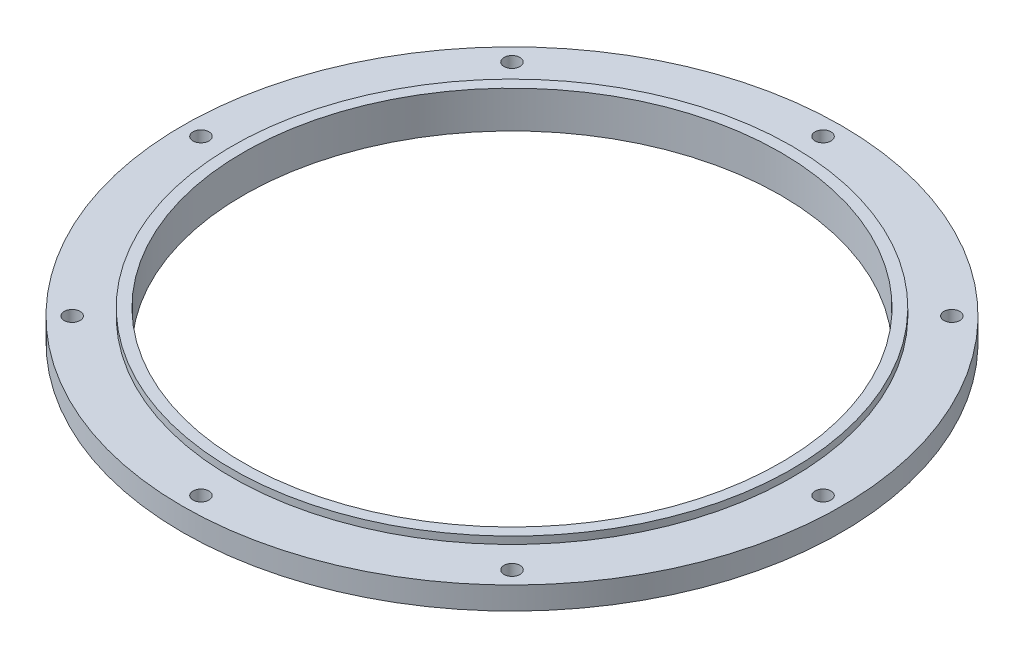
from build123d import *

# Parameters (mm, degrees)
SKETCH_2_R          = 2.15
CUT_EXTRUDE_1_DEPTH = 10


with BuildPart() as part:
    # 草图1 → 旋转1 (revolve)
    with BuildSketch(Plane.XY, mode=Mode.PRIVATE) as revolve_1_sk:
        Polygon((75.5, 0), (88.9, 0), (88.9, 6.1), (75.5, 6.1), (75.5, 8.05), (72.5, 8.05), (72.5, -1.95), (75.5, -1.95), align=None)
    revolve(revolve_1_sk.sketch.rotate(Axis((0, 0, 0), (0, 1, 0)), 90), axis=Axis((0, 0, 0), (0, 1, 0)))

    # 草图2 → 切除-拉伸1 (cut)
    with BuildSketch(Plane(origin=(0, 6.1, 0), x_dir=(1, 0, 0), z_dir=(0, 1, 0))):
        with Locations(Location((-83.9, 0, 0), (0, 0, 270))):
            Circle(SKETCH_2_R)
        with Locations(Location((-59.326258942, 59.326258942, 0), (0, 0, 270))):
            Circle(SKETCH_2_R)
        with Locations(Location((0, 83.9, 0), (0, 0, 270))):
            Circle(SKETCH_2_R)
        with Locations(Location((59.326258942, 59.326258942, 0), (0, 0, 270))):
            Circle(SKETCH_2_R)
        with Locations(Location((83.9, 0, 0), (0, 0, 270))):
            Circle(SKETCH_2_R)
        with Locations(Location((59.326258942, -59.326258942, 0), (0, 0, 270))):
            Circle(SKETCH_2_R)
        with Locations(Location((0, -83.9, 0), (0, 0, 270))):
            Circle(SKETCH_2_R)
        with Locations(Location((-59.326258942, -59.326258942, 0), (0, 0, 270))):
            Circle(SKETCH_2_R)
    extrude(amount=-CUT_EXTRUDE_1_DEPTH, mode=Mode.SUBTRACT)


solid = part.part
